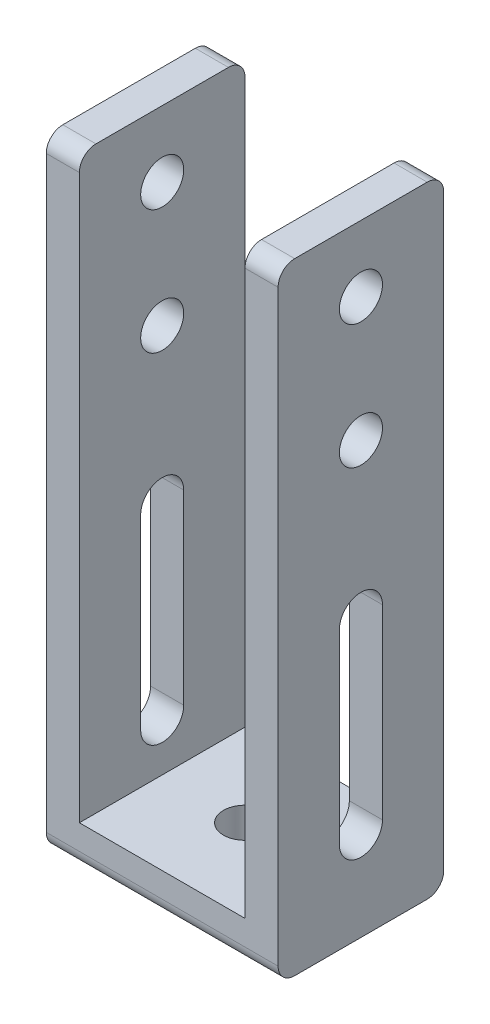
from build123d import *

# Parameters (mm, degrees)
SKETCH1_W           = 28
SKETCH1_H           = 20
BOSS_EXTRUDE1_DEPTH = 5
SKETCH2_W           = 4
SKETCH2_H           = 20
BOSS_EXTRUDE2_DEPTH = 70
SKETCH3_R           = 2.6
CUT_EXTRUDE1_DEPTH  = 5
SKETCH4_R           = 2.6
CUT_EXTRUDE2_DEPTH  = 40
FILLET1_R           = 2


with BuildPart() as part:
    # Sketch1 → Boss-Extrude1 (new body)
    with BuildSketch(Plane(origin=(0, 0, 0), x_dir=(1, 0, 0), z_dir=(0, 1, 0))):
        Rectangle(SKETCH1_W, SKETCH1_H)
    extrude(amount=BOSS_EXTRUDE1_DEPTH)

    # Sketch2 → Boss-Extrude2 (add)
    with BuildSketch(Plane(origin=(0, 5, 0), x_dir=(1, 0, 0), z_dir=(0, 1, 0))):
        with Locations((-12, 0)):
            Rectangle(SKETCH2_W, SKETCH2_H)
        with Locations((12, 0)):
            Rectangle(SKETCH2_W, SKETCH2_H)
    extrude(amount=BOSS_EXTRUDE2_DEPTH)

    # Sketch3 → Cut-Extrude1 (cut)
    with BuildSketch(Plane.XZ):
        with Locations(Location((0, 0, 0), (0, 0, 270))):
            Circle(SKETCH3_R)
    extrude(amount=-CUT_EXTRUDE1_DEPTH, mode=Mode.SUBTRACT)

    # Sketch4 → Cut-Extrude2 (cut)
    with BuildSketch(Plane(origin=(14, 0, 0), x_dir=(0, 0, -1), z_dir=(1, 0, 0))):
        with Locations((0, 67)):
            Circle(SKETCH4_R)
        with Locations((0, 52)):
            Circle(SKETCH4_R)
        with BuildLine():
            Line((2.6, 33.5), (2.6, 11))
            ThreePointArc((2.6, 11), (0, 8.4), (-2.6, 11))
            Line((-2.6, 11), (-2.6, 33.5))
            ThreePointArc((-2.6, 33.5), (0, 36.1), (2.6, 33.5))
        make_face()
    extrude(amount=-CUT_EXTRUDE2_DEPTH, mode=Mode.SUBTRACT)

    # Fillet1
    fillet1_edges = [part.edges().sort_by_distance(p)[0] for p in [
        (-12, 75, 10),
        (-12, 75, -10),
        (12, 75, -10),
        (12, 75, 10),
        (0, 0, 10),
        (0, 0, -10),
    ]]
    fillet(fillet1_edges, radius=FILLET1_R)


solid = part.part
